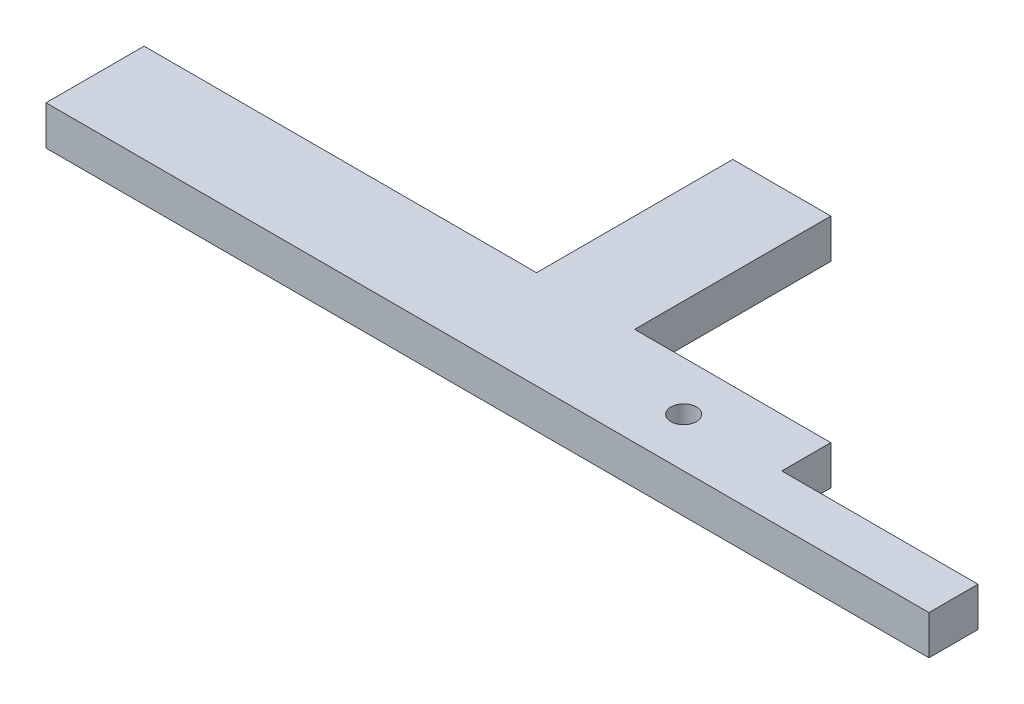
from build123d import *

# Parameters (mm, degrees)
SKETCH1_R           = 3.302
BOSS_EXTRUDE1_DEPTH = 10.16


with BuildPart() as part:
    # Sketch1 → Boss-Extrude1 (new body)
    with BuildSketch(Plane(origin=(0, 0, 0), x_dir=(1, 0, 0), z_dir=(0, 1, 0))):
        Polygon((-25.4, 12.7), (25.4, 12.7), (25.4, 0), (76.2, 0), (76.2, -12.7), (25.4, -12.7), (-152.4, -12.7), (-152.4, 12.7), (-50.8, 12.7), (-50.8, 63.5), (-25.4, 63.5), align=None)
        with Locations(Location((0, 0, 0), (0, 0, 270))):
            Circle(SKETCH1_R, mode=Mode.SUBTRACT)
    extrude(amount=BOSS_EXTRUDE1_DEPTH)


solid = part.part
